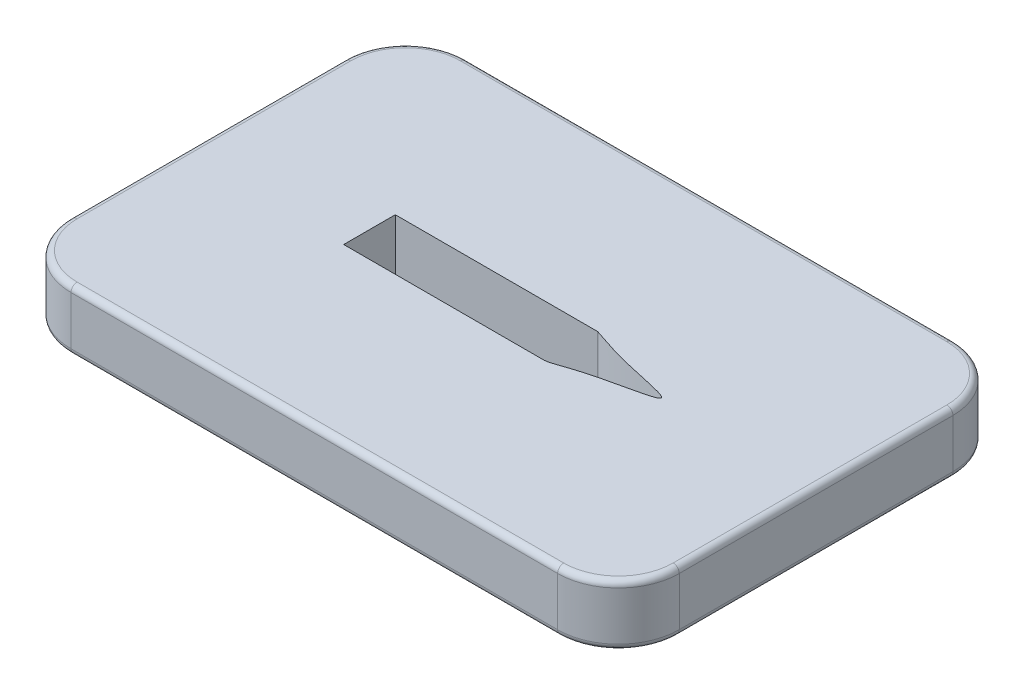
from build123d import *

# Parameters (mm, degrees)
BOSS_EXTRUDE1_DEPTH = 10
CUT_EXTRUDE2_DEPTH  = 10
FILLET1_R           = 1
FILLET2_R           = 1


with BuildPart() as part:
    # Sketch1 → Boss-Extrude1 (new body)
    with BuildSketch(Plane(origin=(0, 0, 0), x_dir=(1, 0, 0), z_dir=(0, 1, 0))):
        with BuildLine():
            Line((-102.94704138, 26.470588235), (-22.94704138, 26.470588235))
            ThreePointArc((-22.94704138, 26.470588235), (-15.875973568, 23.541656047), (-12.94704138, 16.470588235))
            Line((-12.94704138, 16.470588235), (-12.94704138, -28.529411765))
            ThreePointArc((-12.94704138, -28.529411765), (-15.875973568, -35.600479577), (-22.94704138, -38.529411765))
            Line((-22.94704138, -38.529411765), (-102.94704138, -38.529411765))
            ThreePointArc((-102.94704138, -38.529411765), (-110.018109192, -35.600479577), (-112.94704138, -28.529411765))
            Line((-112.94704138, -28.529411765), (-112.94704138, 16.470588235))
            ThreePointArc((-112.94704138, 16.470588235), (-110.018109192, 23.541656047), (-102.94704138, 26.470588235))
        make_face()
    extrude(amount=BOSS_EXTRUDE1_DEPTH)

    # Sketch2 → Cut-Extrude2 (cut)
    with BuildSketch(Plane(origin=(0, 10, 0), x_dir=(1, 0, 0), z_dir=(0, 1, 0))):
        with BuildLine():
            Line((-86.374151264, -1.785526941), (-53.155911565, -1.785526941))
            add(Edge.make_bspline(
                [(-53.155911565, -1.785526941), (-53.129080982, -1.789380086), (-53.1023159, -1.793281348), (-53.075607342, -1.797231207)],
                knots=[0, 0, 0, 0, 0.0009964, 0.0009964, 0.0009964, 0.0009964], degree=3))
            add(Edge.make_bspline(
                [(-53.075607342, -1.797231207), (-51.541485704, -2.316740326), (-45.415602023, -4.422444293), (-33.321239101, -6.01523888), (-45.249562715, -7.639432102), (-51.251453322, -9.678465504), (-52.693570539, -10.167430322)],
                knots=[0, 0, 0, 0, 0.063344572, 0.23684536, 0.40937521, 0.468351292, 0.468351292, 0.468351292, 0.468351292], degree=3))
            add(Edge.make_bspline(
                [(-52.693570539, -10.167430322), (-52.933080229, -10.206733211), (-53.17537239, -10.242094783), (-53.423139068, -10.273296592)],
                knots=[0.31414383, 0.31414383, 0.31414383, 0.31414383, 0.323514461, 0.323514461, 0.323514461, 0.323514461], degree=3))
            Line((-53.423139068, -10.273296592), (-86.374151264, -10.273296592))
            Line((-86.374151264, -10.273296592), (-86.374151264, -1.785526941))
        make_face()
    extrude(amount=-CUT_EXTRUDE2_DEPTH, mode=Mode.SUBTRACT)

    # Fillet1
    fillet1_edges = [part.edges().sort_by_distance(p)[0] for p in [
        (-110.018109192, 10, -23.541656047),
        (-112.94704138, 10, 6.029411765),
        (-110.018109192, 10, 35.600479577),
        (-62.94704138, 10, 38.529411765),
        (-15.875973568, 10, 35.600479577),
        (-12.94704138, 10, 6.029411765),
        (-15.875973568, 10, -23.541656047),
        (-62.94704138, 10, -26.470588235),
    ]]
    fillet(fillet1_edges, radius=FILLET1_R)

    # Fillet2
    fillet2_edges = [part.edges().sort_by_distance(p)[0] for p in [
        (-112.94704138, 0, 6.029411765),
        (-110.018109192, 0, -23.541656047),
        (-62.94704138, 0, -26.470588235),
        (-15.875973568, 0, -23.541656047),
        (-12.94704138, 0, 6.029411765),
        (-15.875973568, 0, 35.600479577),
        (-62.94704138, 0, 38.529411765),
        (-110.018109192, 0, 35.600479577),
    ]]
    fillet(fillet2_edges, radius=FILLET2_R)


solid = part.part
